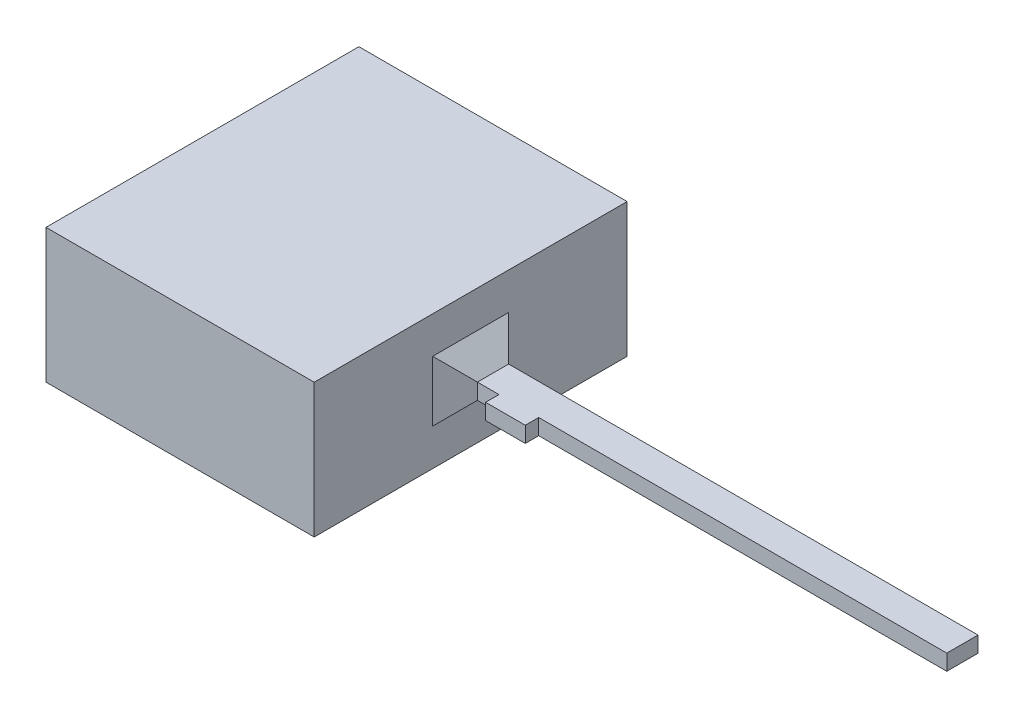
from build123d import *

# Parameters (mm, degrees)
SKETCH1_W           = 6
SKETCH1_H           = 7
BOSS_EXTRUDE1_DEPTH = 3
SKETCH5_W           = 0.698626826
SKETCH5_H           = 0.353353156
BOSS_EXTRUDE3_DEPTH = 0.5
DRAFT1_ANGLE        = 45
SKETCH6_W           = 0.698626826
SKETCH6_H           = 0.353353156
BOSS_EXTRUDE4_DEPTH = 10.5
SKETCH9_W           = 0.888706469
SKETCH9_H           = 0.353353156
BOSS_EXTRUDE5_DEPTH = 0.3


with BuildPart() as part:
    # Sketch1 → Boss-Extrude1 (new body)
    with BuildSketch(Plane(origin=(0, 0, 0), x_dir=(1, 0, 0), z_dir=(0, 1, 0))):
        Rectangle(SKETCH1_W, SKETCH1_H)
    extrude(amount=BOSS_EXTRUDE1_DEPTH)

    # Sketch5 → Boss-Extrude3 (add)
    with BuildSketch(Plane(origin=(3, 0, 0), x_dir=(0, 0, -1), z_dir=(1, 0, 0))):
        with Locations((0, 1.5)):
            Rectangle(SKETCH5_W, SKETCH5_H)
    extrude(amount=BOSS_EXTRUDE3_DEPTH)

    # Draft1
    draft1_faces = [part.faces().sort_by_distance(p)[0] for p in [
        (3.25, 1.323323422, 0),
        (3.25, 1.5, 0.349313413),
        (3.25, 1.676676578, 0),
        (3.25, 1.5, -0.349313413),
    ]]
    draft(draft1_faces, Plane(origin=(3.5, 0, 0), x_dir=(0, 0, 1), z_dir=(1, 0, 0)), DRAFT1_ANGLE)

    # Sketch6 → Boss-Extrude4 (add)
    with BuildSketch(Plane(origin=(3.5, 0, 0), x_dir=(0, 0, -1), z_dir=(1, 0, 0))):
        with Locations((0, 1.5)):
            Rectangle(SKETCH6_W, SKETCH6_H)
    extrude(amount=BOSS_EXTRUDE4_DEPTH)

    # Sketch9 → Boss-Extrude5 (add)
    with BuildSketch(Plane.XY.offset(0.349313413)):
        with Locations((4.427106984, 1.5)):
            Rectangle(SKETCH9_W, SKETCH9_H)
    extrude(amount=BOSS_EXTRUDE5_DEPTH)


solid = part.part
